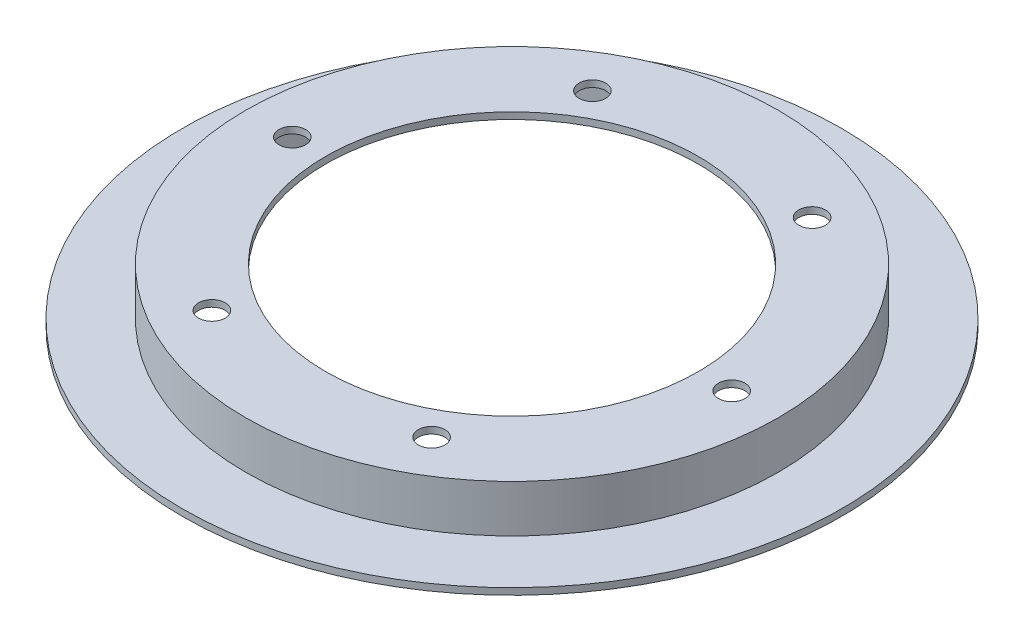
from build123d import *

# Parameters (mm, degrees)
SKETCH_1_R               = 40
SKETCH_1_R_2             = 2
SKETCH_1_R_3             = 28
EXTRUDE_1_DEPTH          = 1
SKETCH_1_3_R             = 40
SKETCH_1_3_R_2           = 39
EXTRUDE_2_DEPTH          = 7.1
SKETCH_2_R               = 49.5
SKETCH_2_R_2             = 39
EXTRUDE_3_DEPTH          = 1
RIB_1_REACH              = 72.471
SKETCH_4_WALL_W          = 154.404684446
SKETCH_4_WALL_H          = 3
PATTERN_CIRCULAR_1_COUNT = 6


with BuildPart() as part:
    # 草图1 → 凸台-拉伸1 (new body)
    with BuildSketch(Plane(origin=(0, 0, 0), x_dir=(1, 0, 0), z_dir=(0, 1, 0))):
        Circle(SKETCH_1_R)
        with Locations((16.5, 28.578838325)):
            Circle(SKETCH_1_R_2, mode=Mode.SUBTRACT)
        with Locations((-16.5, -28.578838325)):
            Circle(SKETCH_1_R_2, mode=Mode.SUBTRACT)
        with Locations((-33, 0)):
            Circle(SKETCH_1_R_2, mode=Mode.SUBTRACT)
        with Locations((16.5, -28.578838325)):
            Circle(SKETCH_1_R_2, mode=Mode.SUBTRACT)
        with Locations((-16.5, 28.578838325)):
            Circle(SKETCH_1_R_2, mode=Mode.SUBTRACT)
        Circle(SKETCH_1_R_3, mode=Mode.SUBTRACT)
        with Locations((33, 0)):
            Circle(SKETCH_1_R_2, mode=Mode.SUBTRACT)
    extrude(amount=-EXTRUDE_1_DEPTH)

    # 草图1<3> → 凸台-拉伸2 (add)
    with BuildSketch(Plane(origin=(0, 0, 0), x_dir=(1, 0, 0), z_dir=(0, 1, 0))):
        Circle(SKETCH_1_3_R)
        Circle(SKETCH_1_3_R_2, mode=Mode.SUBTRACT)
    extrude(amount=-EXTRUDE_2_DEPTH)

    # 草图2 → 凸台-拉伸3 (add)
    with BuildSketch(Plane.XZ.offset(7.1)):
        Circle(SKETCH_2_R)
        Circle(SKETCH_2_R_2, mode=Mode.SUBTRACT)
    extrude(amount=EXTRUDE_3_DEPTH)

    # 草图4 wall → 筋1 (add, up to next)
    with BuildSketch(Plane(origin=(0, -4.55, -34.5), x_dir=(0, 0.619361407728, 0.785106009796), z_dir=(0, -0.785106009796, 0.619361407728)), mode=Mode.PRIVATE) as rib_1_sk1:
        Rectangle(SKETCH_4_WALL_W, SKETCH_4_WALL_H)
    rib_1_tool1 = extrude(rib_1_sk1.sketch, amount=-RIB_1_REACH, mode=Mode.PRIVATE) - part.part
    rib_1 = rib_1_tool1.solids().sort_by_distance((0, -4.55, -34.5))[0]
    add(rib_1)

    # 阵列(圆周)1: 筋1 ×6 about axis
    pattern_circular_1_axis = Axis((0, -7.1, 0), (0, 1, 0))
    for i in range(1, PATTERN_CIRCULAR_1_COUNT):
        add(rib_1.rotate(pattern_circular_1_axis, i * 360 / PATTERN_CIRCULAR_1_COUNT))


solid = part.part
